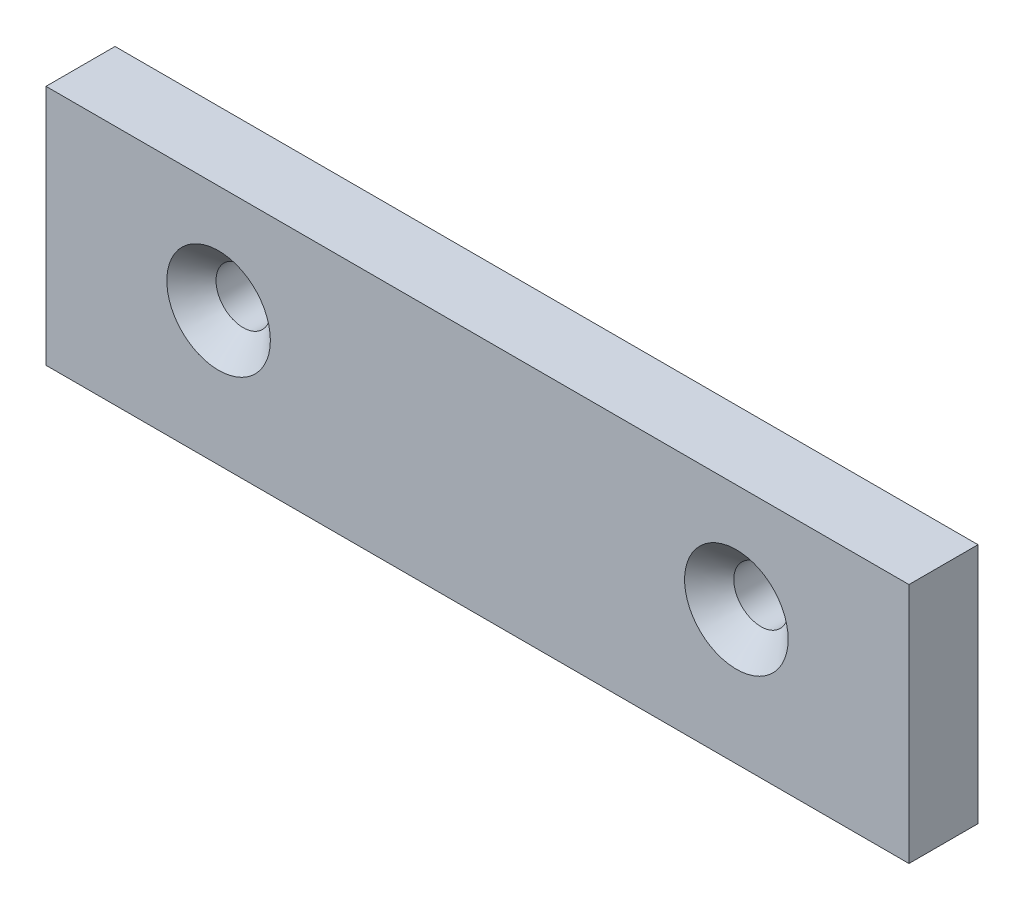
from build123d import *

# Parameters (mm, degrees)
SKETCH1_W           = 100
SKETCH1_H           = 28
BOSS_EXTRUDE1_DEPTH = 8
HOLE1_D             = 6.3
HOLE1_DEPTH         = 50
HOLE1_CSINK_D       = 12
HOLE1_CSINK_ANGLE   = 90


with BuildPart() as part:
    # Sketch1 → Boss-Extrude1 (new body)
    with BuildSketch(Plane.XY):
        Rectangle(SKETCH1_W, SKETCH1_H)
    extrude(amount=BOSS_EXTRUDE1_DEPTH)

    # Hole1
    with Locations(Plane(origin=(-30, 1.5, 8), x_dir=(1, 0, 0), z_dir=(0, 0, 1))):
        with Locations((0, 0), (60, 0)):
            CounterSinkHole(HOLE1_D / 2, HOLE1_CSINK_D / 2, depth=HOLE1_DEPTH, counter_sink_angle=HOLE1_CSINK_ANGLE)


solid = part.part
